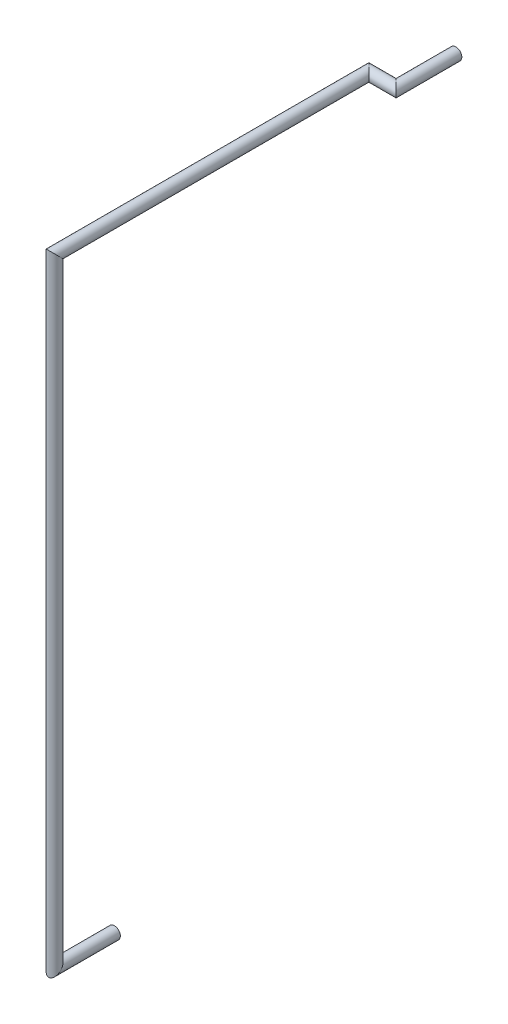
from build123d import *

# Parameters (mm, degrees)
ESQUISSE1_R = 0.5


with BuildPart() as part:
    # Balayage1: sweep along a curve in space
    with BuildLine() as balayage1_path:
        Line((0, 0, 0), (0, 0, 5))
        Line((0, 0, 5), (0, 51.68, 5))
        Line((0, 51.68, 5), (0, 51.68, -21.29))
        Line((0, 51.68, -21.29), (2.28, 51.68, -21.29))
        Line((2.28, 51.68, -21.29), (2.28, 51.68, -26.29))
    # Esquisse1 → Balayage1 (sweep)
    with BuildSketch(Plane(origin=(0, 0, 0), x_dir=(0, 1, 0), z_dir=(0, 0, 1))):
        Circle(ESQUISSE1_R)
    sweep(path=balayage1_path.line, transition=Transition.RIGHT)


solid = part.part
